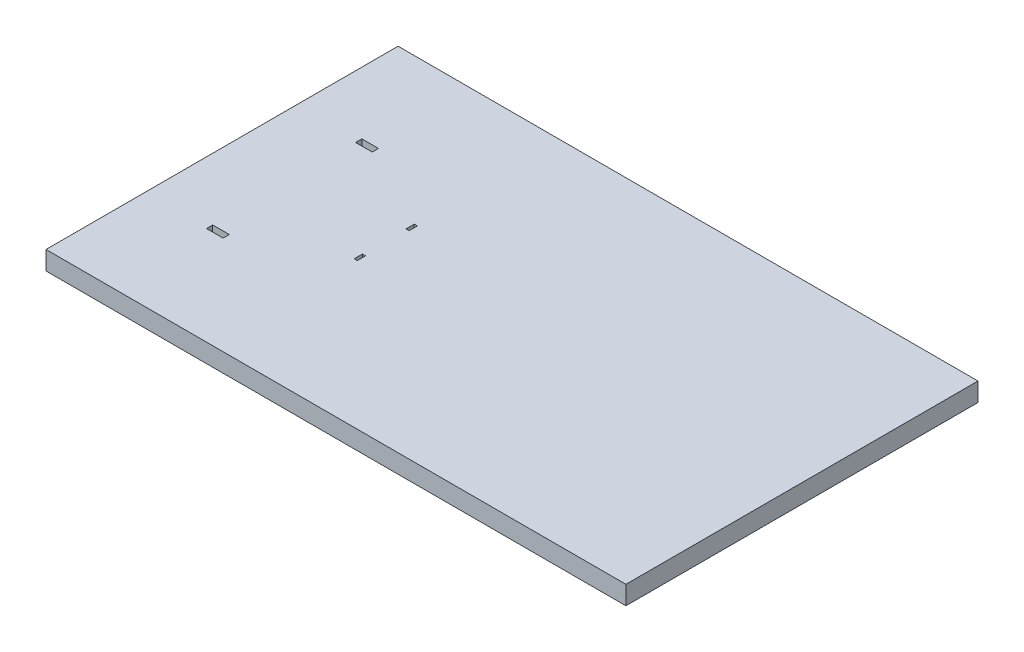
from build123d import *

# Parameters (mm, degrees)
SKETCH1_W           = 28
SKETCH1_H           = 17
SKETCH1_W_2         = 0.8
SKETCH1_H_2         = 0.3
SKETCH1_W_3         = 0.15
SKETCH1_H_3         = 0.4
BOSS_EXTRUDE1_DEPTH = 0.9


with BuildPart() as part:
    # Sketch1 → Boss-Extrude1 (new body)
    with BuildSketch(Plane(origin=(0, 0, 0), x_dir=(1, 0, 0), z_dir=(0, 1, 0))):
        Rectangle(SKETCH1_W, SKETCH1_H)
        with Locations((-10.6, -3.6)):
            Rectangle(SKETCH1_W_2, SKETCH1_H_2, mode=Mode.SUBTRACT)
        with Locations((-10.6, 3.6)):
            Rectangle(SKETCH1_W_2, SKETCH1_H_2, mode=Mode.SUBTRACT)
        with Locations((-6.095, -1.25)):
            Rectangle(SKETCH1_W_3, SKETCH1_H_3, mode=Mode.SUBTRACT)
        with Locations((-6.095, 1.25)):
            Rectangle(SKETCH1_W_3, SKETCH1_H_3, mode=Mode.SUBTRACT)
    extrude(amount=BOSS_EXTRUDE1_DEPTH)


solid = part.part
